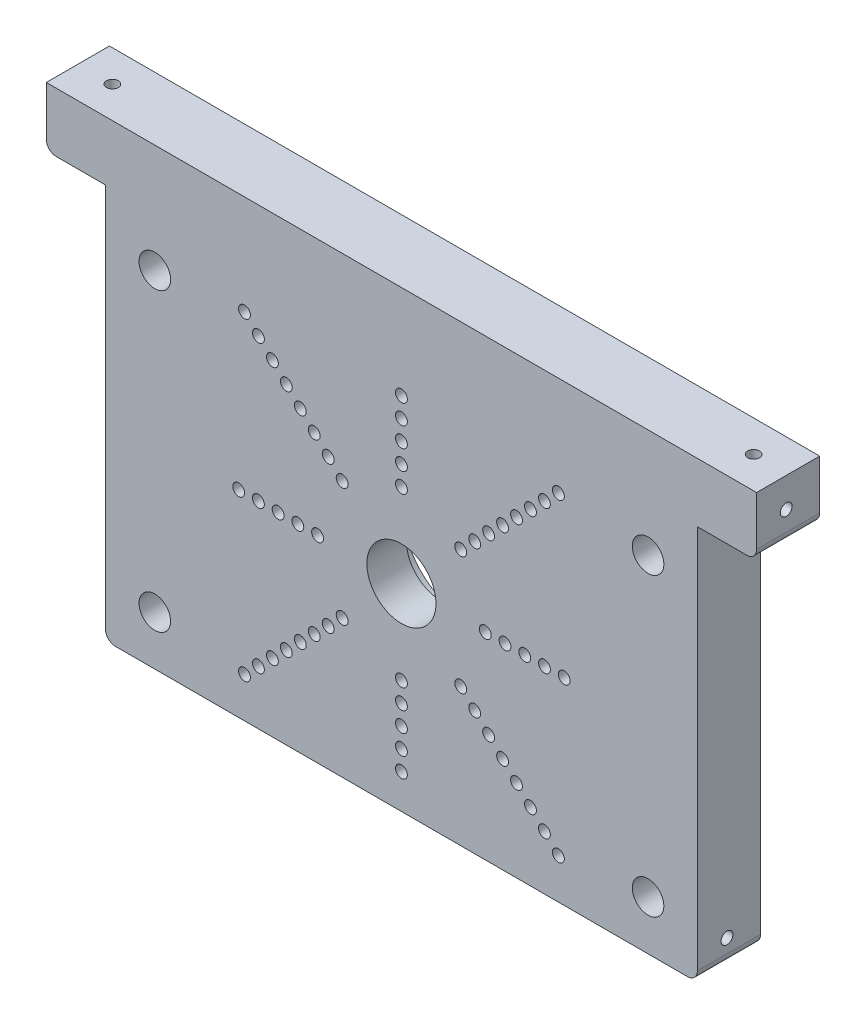
from build123d import *

# Parameters (mm, degrees)
SKETCH1_W           = 300
SKETCH1_H           = 200
SKETCH1_R           = 8
BOSS_EXTRUDE1_DEPTH = 32
SKETCH2_R           = 3
CUT_EXTRUDE2_DEPTH  = 32
CUT_EXTRUDE4_DEPTH  = 16
FILLET4_R           = 10
FILLET8_R           = 10
BOSS_EXTRUDE2_DEPTH = 32
SKETCH6_R           = 31
CUT_EXTRUDE5_DEPTH  = 12
SKETCH7_R           = 17.5
CUT_EXTRUDE6_DEPTH  = 106
FILLET9_R           = 5
SKETCH8_R           = 3
CUT_EXTRUDE7_DEPTH  = 10
CUT_EXTRUDE8_START  = -10
SKETCH9_R           = 3
CUT_EXTRUDE8_DEPTH  = 10
SKETCH10_R          = 3
CUT_EXTRUDE9_DEPTH  = 10
CUT_EXTRUDE10_START = -10
SKETCH11_R          = 3
CUT_EXTRUDE10_DEPTH = 10
SKETCH12_R          = 3
CUT_EXTRUDE11_DEPTH = 90
SKETCH13_R          = 3
CUT_EXTRUDE12_DEPTH = 5
SKETCH14_R          = 3
CUT_EXTRUDE13_DEPTH = 5


with BuildPart() as part:
    # Sketch1 → Boss-Extrude1 (new body)
    with BuildSketch(Plane.XY):
        Rectangle(SKETCH1_W, SKETCH1_H)
        with Locations((125, 75)):
            Circle(SKETCH1_R, mode=Mode.SUBTRACT)
        with Locations((125, -75)):
            Circle(SKETCH1_R, mode=Mode.SUBTRACT)
        with Locations((-125, -75)):
            Circle(SKETCH1_R, mode=Mode.SUBTRACT)
        with Locations((-125, 75)):
            Circle(SKETCH1_R, mode=Mode.SUBTRACT)
    extrude(amount=BOSS_EXTRUDE1_DEPTH)

    # Sketch2 → Cut-Extrude2 (cut)
    with BuildSketch(Plane.XY.offset(32)):
        with Locations((58.336309448, -58.336309448)):
            Circle(SKETCH2_R)
        with Locations((51.265241636, -51.265241636)):
            Circle(SKETCH2_R)
        with Locations((44.194173824, -44.194173824)):
            Circle(SKETCH2_R)
        with Locations((37.123106012, -37.123106012)):
            Circle(SKETCH2_R)
        with Locations((30.0520382, -30.0520382)):
            Circle(SKETCH2_R)
        with Locations((-65.40737726, 65.40737726)):
            Circle(SKETCH2_R)
        with Locations((-72.478445072, 72.478445072)):
            Circle(SKETCH2_R)
        with Locations((42.5, 0)):
            Circle(SKETCH2_R)
        with Locations((52.5, 0)):
            Circle(SKETCH2_R)
        with Locations((62.5, 0)):
            Circle(SKETCH2_R)
        with Locations((72.5, 0)):
            Circle(SKETCH2_R)
        with Locations((82.5, 0)):
            Circle(SKETCH2_R)
        with Locations((-79.549512883, 79.549512883)):
            Circle(SKETCH2_R)
        with Locations((0, -82.5)):
            Circle(SKETCH2_R)
        with Locations((0, -72.5)):
            Circle(SKETCH2_R)
        with Locations((0, -62.5)):
            Circle(SKETCH2_R)
        with Locations((0, -52.5)):
            Circle(SKETCH2_R)
        with Locations((0, -42.5)):
            Circle(SKETCH2_R)
        with Locations((65.40737726, 65.40737726)):
            Circle(SKETCH2_R)
        with Locations((72.478445072, 72.478445072)):
            Circle(SKETCH2_R)
        with Locations((-58.336309448, -58.336309448)):
            Circle(SKETCH2_R)
        with Locations((-51.265241636, -51.265241636)):
            Circle(SKETCH2_R)
        with Locations((-44.194173824, -44.194173824)):
            Circle(SKETCH2_R)
        with Locations((-37.123106012, -37.123106012)):
            Circle(SKETCH2_R)
        with Locations((-30.0520382, -30.0520382)):
            Circle(SKETCH2_R)
        with Locations((79.549512883, 79.549512883)):
            Circle(SKETCH2_R)
        with Locations((-82.5, 0)):
            Circle(SKETCH2_R)
        with Locations((-72.5, 0)):
            Circle(SKETCH2_R)
        with Locations((-62.5, 0)):
            Circle(SKETCH2_R)
        with Locations((-52.5, 0)):
            Circle(SKETCH2_R)
        with Locations((-42.5, 0)):
            Circle(SKETCH2_R)
        with Locations((65.40737726, -65.40737726)):
            Circle(SKETCH2_R)
        with Locations((72.478445072, -72.478445072)):
            Circle(SKETCH2_R)
        with Locations((-58.336309448, 58.336309448)):
            Circle(SKETCH2_R)
        with Locations((-51.265241636, 51.265241636)):
            Circle(SKETCH2_R)
        with Locations((-44.194173824, 44.194173824)):
            Circle(SKETCH2_R)
        with Locations((-37.123106012, 37.123106012)):
            Circle(SKETCH2_R)
        with Locations((-30.0520382, 30.0520382)):
            Circle(SKETCH2_R)
        with Locations((79.549512883, -79.549512883)):
            Circle(SKETCH2_R)
        with Locations((0, 82.5)):
            Circle(SKETCH2_R)
        with Locations((0, 72.5)):
            Circle(SKETCH2_R)
        with Locations((0, 62.5)):
            Circle(SKETCH2_R)
        with Locations((0, 52.5)):
            Circle(SKETCH2_R)
        with Locations((0, 42.5)):
            Circle(SKETCH2_R)
        with Locations((-65.40737726, -65.40737726)):
            Circle(SKETCH2_R)
        with Locations((-72.478445072, -72.478445072)):
            Circle(SKETCH2_R)
        with Locations((58.336309448, 58.336309448)):
            Circle(SKETCH2_R)
        with Locations((51.265241636, 51.265241636)):
            Circle(SKETCH2_R)
        with Locations((44.194173824, 44.194173824)):
            Circle(SKETCH2_R)
        with Locations((37.123106012, 37.123106012)):
            Circle(SKETCH2_R)
        with Locations((30.0520382, 30.0520382)):
            Circle(SKETCH2_R)
        with Locations((-79.549512883, -79.549512883)):
            Circle(SKETCH2_R)
    extrude(amount=-CUT_EXTRUDE2_DEPTH, mode=Mode.SUBTRACT)

    # Sketch4 → Cut-Extrude4 (cut)
    with BuildSketch(Plane(origin=(0, 0, 0), x_dir=(-1, 0, 0), z_dir=(0, 0, -1))):
        with BuildLine():
            ThreePointArc((-91.942153666, 81.335551948), (-125.113286784, 50.428772354), (-139.696619787, 7.5))
            Line((-139.696619787, 7.5), (-18.106601718, 7.5))
            Line((-18.106601718, 7.5), (-91.942153666, 81.335551948))
        make_face()
        with BuildLine():
            ThreePointArc((-7.5, 83.969594837), (-41.99087281, 92.714109158), (-77.238242942, 87.844844659))
            Line((-77.238242942, 87.844844659), (-7.5, 18.106601718))
            Line((-7.5, 18.106601718), (-7.5, 83.969594837))
        make_face()
        with BuildLine():
            Line((7.5, 18.106601718), (77.238242942, 87.844844659))
            ThreePointArc((77.238242942, 87.844844659), (41.99087281, 92.714109158), (7.5, 83.969594837))
            Line((7.5, 83.969594837), (7.5, 18.106601718))
        make_face()
        with BuildLine():
            Line((18.106601718, 7.5), (139.696619787, 7.5))
            ThreePointArc((139.696619787, 7.5), (125.113286784, 50.428772354), (91.942153666, 81.335551948))
            Line((91.942153666, 81.335551948), (18.106601718, 7.5))
        make_face()
        with BuildLine():
            Line((18.106601718, -7.5), (91.942153666, -81.335551948))
            ThreePointArc((91.942153666, -81.335551948), (125.113286784, -50.428772354), (139.696619787, -7.5))
            Line((139.696619787, -7.5), (18.106601718, -7.5))
        make_face()
        with BuildLine():
            Line((7.5, -18.106601718), (7.5, -83.969594837))
            ThreePointArc((7.5, -83.969594837), (41.99087281, -92.714109158), (77.238242942, -87.844844659))
            Line((77.238242942, -87.844844659), (7.5, -18.106601718))
        make_face()
        with BuildLine():
            Line((-7.5, -83.969594837), (-7.5, -18.106601718))
            Line((-7.5, -18.106601718), (-77.238242942, -87.844844659))
            ThreePointArc((-77.238242942, -87.844844659), (-41.99087281, -92.714109158), (-7.5, -83.969594837))
        make_face()
        with BuildLine():
            ThreePointArc((-139.696619787, -7.5), (-125.113286784, -50.428772354), (-91.942153666, -81.335551948))
            Line((-91.942153666, -81.335551948), (-18.106601718, -7.5))
            Line((-18.106601718, -7.5), (-139.696619787, -7.5))
        make_face()
    extrude(amount=-CUT_EXTRUDE4_DEPTH, mode=Mode.SUBTRACT)

    # Fillet4
    fillet4_edges = [part.edges().sort_by_distance(p)[0] for p in [
        (18.106601718, 7.5, 8),
        (7.5, 18.106601718, 8),
        (-18.106601718, 7.5, 8),
        (-7.5, 18.106601718, 8),
        (-7.5, -18.106601718, 8),
        (-18.106601718, -7.5, 8),
        (18.106601718, -7.5, 8),
        (7.5, -18.106601718, 8),
    ]]
    fillet(fillet4_edges, radius=FILLET4_R)

    # Fillet8
    fillet8_edges = [part.edges().sort_by_distance(p)[0] for p in [
        (91.942153666, 81.335551948, 8),
        (139.696619787, 7.5, 8),
        (7.5, 83.969594837, 8),
        (77.238242942, 87.844844659, 8),
        (-91.942153666, 81.335551948, 8),
        (-139.696619787, 7.5, 8),
        (-7.5, 83.969594837, 8),
        (-77.238242942, 87.844844659, 8),
        (-77.238242942, -87.844844659, 8),
        (-7.5, -83.969594837, 8),
        (-139.696619787, -7.5, 8),
        (-91.942153666, -81.335551948, 8),
        (139.696619787, -7.5, 8),
        (91.942153666, -81.335551948, 8),
        (77.238242942, -87.844844659, 8),
        (7.5, -83.969594837, 8),
    ]]
    fillet(fillet8_edges, radius=FILLET8_R)

    # Sketch5 → Boss-Extrude2 (add)
    with BuildSketch(Plane(origin=(0, 0, 0), x_dir=(-1, 0, 0), z_dir=(0, 0, -1))):
        Polygon((-150, 100), (-180, 100), (-180, 130), (180, 130), (180, 100), (150, 100), align=None)
    extrude(amount=-BOSS_EXTRUDE2_DEPTH)

    # Sketch6 → Cut-Extrude5 (cut)
    with BuildSketch(Plane(origin=(0, 0, 0), x_dir=(-1, 0, 0), z_dir=(0, 0, -1))):
        Circle(SKETCH6_R)
    extrude(amount=-CUT_EXTRUDE5_DEPTH, mode=Mode.SUBTRACT)

    # Sketch7 → Cut-Extrude6 (cut)
    with BuildSketch(Plane(origin=(0, 0, 12), x_dir=(-1, 0, 0), z_dir=(0, 0, -1))):
        Circle(SKETCH7_R)
    extrude(amount=-CUT_EXTRUDE6_DEPTH, mode=Mode.SUBTRACT)

    # Fillet9
    fillet9_edges = [part.edges().sort_by_distance(p)[0] for p in [
        (-180, 100, 16),
        (180, 100, 16),
        (150, -100, 16),
        (-150, -100, 16),
    ]]
    fillet(fillet9_edges, radius=FILLET9_R)

    # Sketch8 → Cut-Extrude7 (cut)
    with BuildSketch(Plane(origin=(180, 0, 0), x_dir=(0, 0, -1), z_dir=(1, 0, 0))):
        with Locations((-17, 115)):
            Circle(SKETCH8_R)
    extrude(amount=-CUT_EXTRUDE7_DEPTH, mode=Mode.SUBTRACT)

    # Sketch9 → Cut-Extrude8 (cut)
    with BuildSketch(Plane.ZY.offset(180).offset(CUT_EXTRUDE8_START)):
        with Locations(Location((17, 115, 0), (0, 0, 180))):
            Circle(SKETCH9_R)
    extrude(amount=CUT_EXTRUDE8_DEPTH, mode=Mode.SUBTRACT)

    # Sketch10 → Cut-Extrude9 (cut)
    with BuildSketch(Plane.ZY.offset(150)):
        with Locations(Location((17, -88, 0), (0, 0, 270))):
            Circle(SKETCH10_R)
    extrude(amount=-CUT_EXTRUDE9_DEPTH, mode=Mode.SUBTRACT)

    # Sketch11 → Cut-Extrude10 (cut)
    with BuildSketch(Plane(origin=(150, 0, 0), x_dir=(0, 0, -1), z_dir=(1, 0, 0)).offset(CUT_EXTRUDE10_START)):
        with Locations(Location((-17, -88, 0), (0, 0, 270))):
            Circle(SKETCH11_R)
    extrude(amount=CUT_EXTRUDE10_DEPTH, mode=Mode.SUBTRACT)

    # Sketch12 → Cut-Extrude11 (cut)
    with BuildSketch(Plane(origin=(0, 100, 0), x_dir=(-1, 0, 0), z_dir=(0, -1, 0))):
        with Locations(Location((162.5, -16, 0), (0, 0, 90))):
            Circle(SKETCH12_R)
        with Locations(Location((-162.5, -16, 0), (0, 0, 90))):
            Circle(SKETCH12_R)
    extrude(amount=-CUT_EXTRUDE11_DEPTH, mode=Mode.SUBTRACT)

    # Sketch13 → Cut-Extrude12 (cut)
    with BuildSketch(Plane(origin=(0, -100, 0), x_dir=(-1, 0, 0), z_dir=(0, -1, 0))):
        with Locations(Location((138, -17, 0), (0, 0, 180))):
            Circle(SKETCH13_R)
    extrude(amount=-CUT_EXTRUDE12_DEPTH, mode=Mode.SUBTRACT)

    # Sketch14 → Cut-Extrude13 (cut)
    with BuildSketch(Plane(origin=(0, -100, 0), x_dir=(-1, 0, 0), z_dir=(0, -1, 0))):
        with Locations(Location((-138, -17, 0), (0, 0, 180))):
            Circle(SKETCH14_R)
    extrude(amount=-CUT_EXTRUDE13_DEPTH, mode=Mode.SUBTRACT)


solid = part.part
